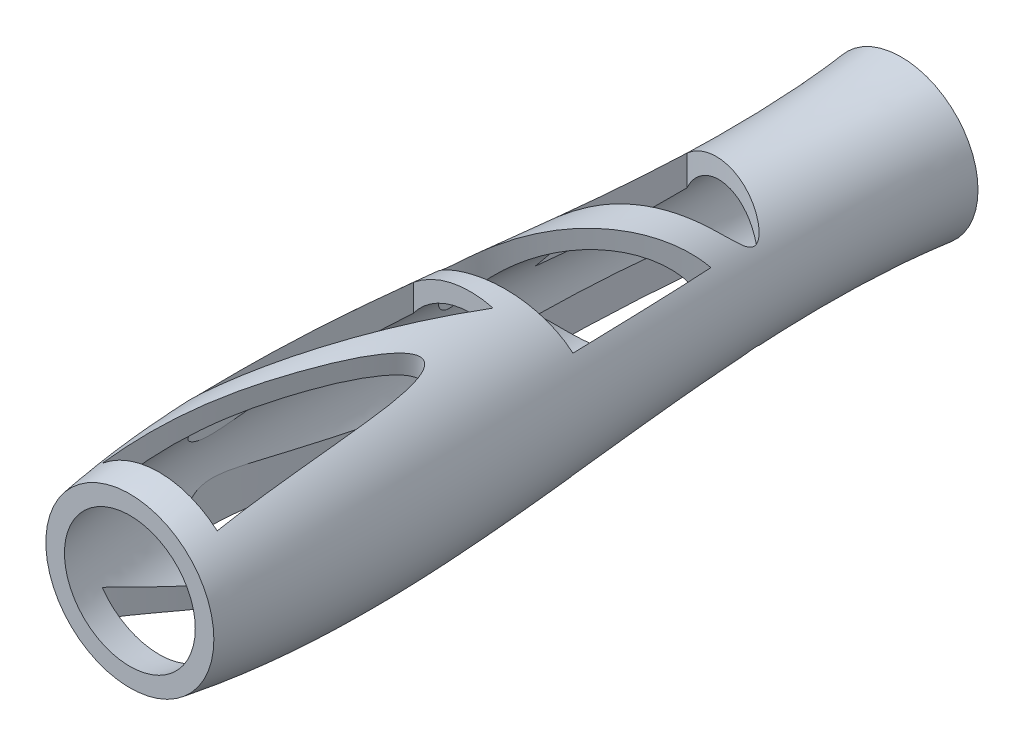
from build123d import *

# Parameters (mm, degrees)
SHELL2_T                = -0.005
CUT_EXTRUDE1_DEPTH      = 10
CUT_EXTRUDE1_DEPTH_BACK = 10


with BuildPart() as part:
    # Sketch1 → Revolve1 (revolve)
    with BuildSketch(Plane(origin=(0, 0, 0), x_dir=(1, 0, 0), z_dir=(0, 1, 0))):
        with BuildLine():
            Line((0, -0.014856576), (0, 0.195040791))
            Line((0, 0.195040791), (0.020885225, 0.195040791))
            add(Edge.make_bspline(
                [(0.022860854, -0.014856576), (0.034063037, 0.055077764), (0.013445211, 0.124871483), (0.020885225, 0.195040791)],
                knots=[0, 0, 0, 0, 1, 1, 1, 1], degree=3))
            Line((0.022860854, -0.014856576), (0, -0.014856576))
        make_face()
    revolve(axis=Axis((0, 0, 0.014856576), (0, 0, -1)))

    # Shell2
    shell2_openings = [part.faces().sort_by_distance(p)[0] for p in [
        (0, 0, 0.014856576),
    ]]
    offset(amount=SHELL2_T, openings=shell2_openings, kind=Kind.INTERSECTION)

    # Sketch2 → Cut-Extrude1 (cut, two sides: drawn at the far end of the back side and taken through both)
    with BuildSketch(Plane(origin=(0, 0, 0), x_dir=(1, 0, 0), z_dir=(0, 1, 0)).offset(-CUT_EXTRUDE1_DEPTH_BACK)):
        with BuildLine():
            Line((-0.015522802, -0.00688884), (0.015805035, -0.00688884))
            add(Edge.make_bspline(
                [(-0.015522802, -0.00688884), (-0.01352438, 0.007355888), (0.001018716, 0.039213808), (0.015054275, 0.084408932), (0.015805035, -0.00688884)],
                knots=[0, 0, 0, 0, 0.360507195, 1, 1, 1, 1], degree=3))
        make_face()
        with BuildLine():
            Line((-0.015522802, 0.077780991), (0.006209121, 0.077780991))
            add(Edge.make_bspline(
                [(-0.015522802, 0.077780991), (-0.032292751, -0.038141756), (0.006209121, 0.077780991)],
                knots=[0, 0, 0, 1, 1, 1], degree=2))
        make_face()
        with BuildLine():
            Line((0.018627363, 0.087094672), (0.015805035, 0.127453958))
            add(Edge.make_bspline(
                [(0.018627363, 0.087094672), (-0.052075169, 0.069051812), (0.015805035, 0.127453958)],
                knots=[0, 0, 0, 1, 1, 1], degree=2))
        make_face()
        with BuildLine():
            Line((-0.015522802, 0.110802225), (-0.012982707, 0.149750346))
            add(Edge.make_bspline(
                [(-0.012982707, 0.149750346), (0.051476241, 0.140599382), (-0.012304826, 0.12698582), (-0.015522802, 0.110802225)],
                knots=[0, 0, 0, 0, 1, 1, 1, 1], degree=3))
        make_face()
    extrude(amount=CUT_EXTRUDE1_DEPTH + CUT_EXTRUDE1_DEPTH_BACK, mode=Mode.SUBTRACT)


solid = part.part
